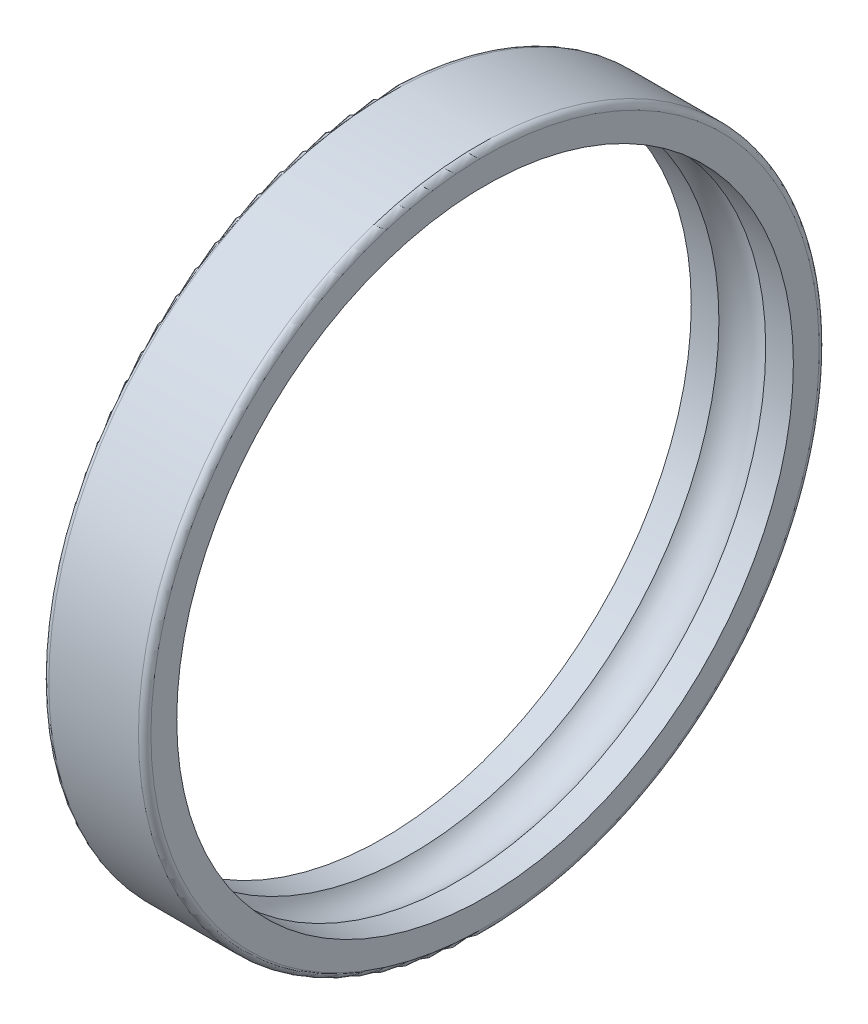
from build123d import *


with BuildPart() as part:
    # Schizzo1 → Rivoluzione1 (revolve)
    with BuildSketch(Plane.XY, mode=Mode.PRIVATE) as rivoluzione1_sk:
        with BuildLine():
            Line((0, 58.9), (0, 54.35))
            Line((0, 54.35), (4.875628502, 54.35))
            ThreePointArc((4.875628502, 54.35), (9, 56.4095), (13.124371498, 54.35))
            Line((13.124371498, 54.35), (18, 54.35))
            Line((18, 54.35), (18, 58.9))
            ThreePointArc((18, 58.9), (17.677817459, 59.677817459), (16.9, 60))
            Line((16.9, 60), (1.1, 60))
            ThreePointArc((1.1, 60), (0.322182541, 59.677817459), (0, 58.9))
        make_face()
    revolve(rivoluzione1_sk.sketch.rotate(Axis((200, 0, 0), (-1, 0, 0)), 270), axis=Axis((200, 0, 0), (-1, 0, 0)))


solid = part.part
